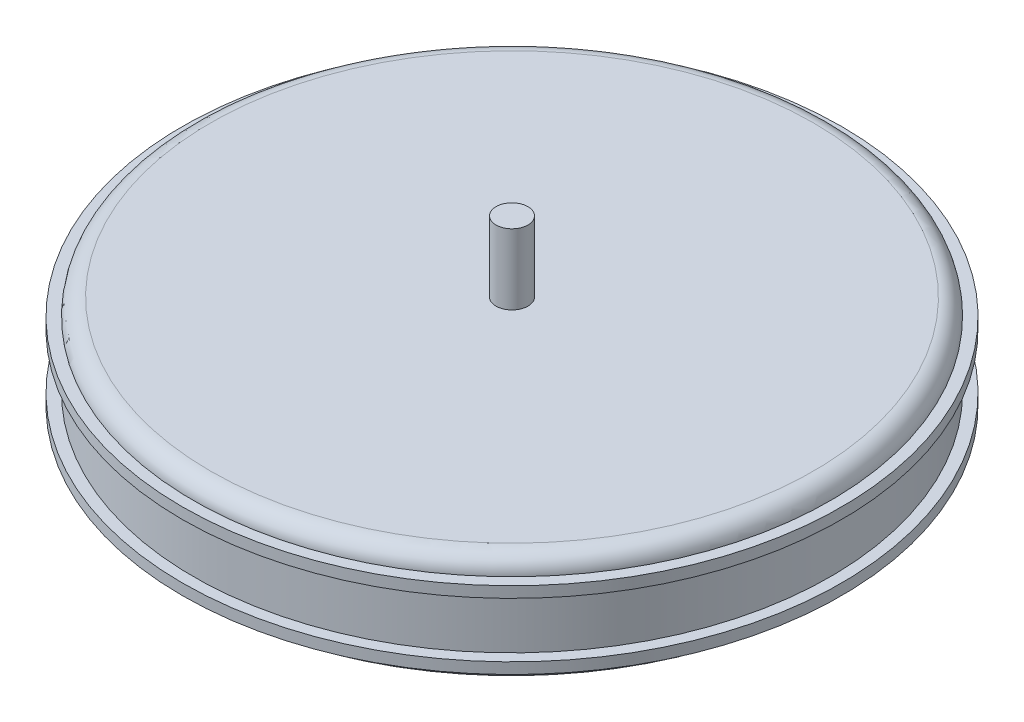
from build123d import *


with BuildPart() as part:
    # Sketch3 → Revolve1 (revolve)
    with BuildSketch(Plane(origin=(0, 0, 0), x_dir=(0, 0, -1), z_dir=(1, 0, 0)), mode=Mode.PRIVATE) as revolve1_sk:
        with BuildLine():
            Line((-7.25, 44.75), (-7.25, 12.75))
            Line((-7.25, 12.75), (-137.25, 12.75))
            ThreePointArc((-137.25, 12.75), (-142.730077554, 10.480077554), (-145, 5))
            Line((-145, 5), (-150, 5))
            Line((-150, 5), (-150, 0))
            Line((-150, 0), (-145, 0))
            Line((-145, 0), (-145, -25))
            Line((-145, -25), (-150, -25))
            Line((-150, -25), (-150, -30))
            Line((-150, -30), (-145, -30))
            ThreePointArc((-145, -30), (-142.730077554, -35.480077554), (-137.25, -37.75))
            Line((-137.25, -37.75), (-7.25, -37.75))
            Line((-7.25, -37.75), (-7.25, -69.75))
            Line((-7.25, -69.75), (0, -69.75))
            Line((0, -69.75), (0, 44.75))
            Line((0, 44.75), (-7.25, 44.75))
        make_face()
    revolve(revolve1_sk.sketch.rotate(Axis((0, -69.75, 0), (0, 1, 0)), 180), axis=Axis((0, -69.75, 0), (0, 1, 0)))


solid = part.part
